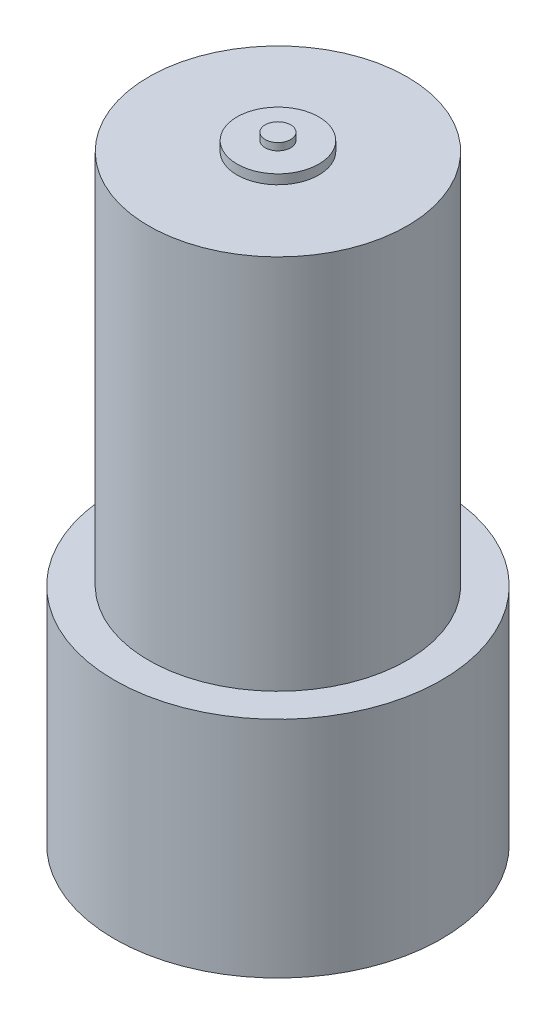
from build123d import *

# Parameters (mm, degrees)
SKETCH1_R                  = 25.4
BOSS_EXTRUDE1_DEPTH        = 34.798
SKETCH2_R                  = 20.066
BOSS_EXTRUDE2_DEPTH        = 58.42
SKETCH3_R                  = 14.224
BOSS_EXTRUDE3_DEPTH        = 1.524
SKETCH4_R                  = 6.35
BOSS_EXTRUDE4_DEPTH        = 1.4732
SKETCH5_R                  = 1.9812
BOSS_EXTRUDE5_DEPTH        = 1.1176
SKETCH6_R                  = 2.9464
BOSS_EXTRUDE6_DEPTH        = 17.526
F_10_32_TAPPED_HOLE1_D     = 4.0386
F_10_32_TAPPED_HOLE1_DEPTH = 6.35
F_10_32_TAPPED_HOLE1_TIP   = 1.213317848


with BuildPart() as part:
    # Sketch1 → Boss-Extrude1 (new body)
    with BuildSketch(Plane(origin=(0, 0, 0), x_dir=(1, 0, 0), z_dir=(0, 1, 0))):
        with Locations(Location((0, 0, 0), (0, 0, 270))):
            Circle(SKETCH1_R)
    extrude(amount=BOSS_EXTRUDE1_DEPTH)

    # Sketch2 → Boss-Extrude2 (add)
    with BuildSketch(Plane(origin=(0, 34.798, 0), x_dir=(-1, 0, 0), z_dir=(0, 1, 0))):
        with Locations(Location((0, 0, 0), (0, 0, 270))):
            Circle(SKETCH2_R)
    extrude(amount=BOSS_EXTRUDE2_DEPTH)

    # Sketch3 → Boss-Extrude3 (add)
    with BuildSketch(Plane.XZ):
        with Locations(Location((0, 0, 0), (0, 0, 90))):
            Circle(SKETCH3_R)
    extrude(amount=BOSS_EXTRUDE3_DEPTH)

    # Sketch4 → Boss-Extrude4 (add)
    with BuildSketch(Plane(origin=(0, 93.218, 0), x_dir=(-1, 0, 0), z_dir=(0, 1, 0))):
        with Locations(Location((0, 0, 0), (0, 0, 90))):
            Circle(SKETCH4_R)
    extrude(amount=BOSS_EXTRUDE4_DEPTH)

    # Sketch5 → Boss-Extrude5 (add)
    with BuildSketch(Plane(origin=(0, 94.6912, 0), x_dir=(1, 0, 0), z_dir=(0, 1, 0))):
        with Locations(Location((0, 0, 0), (0, 0, 270))):
            Circle(SKETCH5_R)
    extrude(amount=BOSS_EXTRUDE5_DEPTH)

    # Sketch6 → Boss-Extrude6 (add)
    with BuildSketch(Plane.XZ):
        with Locations(Location((-4.1783, 0, 0), (0, 0, 270))):
            Circle(SKETCH6_R)
    extrude(amount=BOSS_EXTRUDE6_DEPTH)

    # #10-32 Tapped Hole1
    with Locations(Plane.XZ):
        with Locations((0, 19.05), (0, -19.05)):
            Hole(F_10_32_TAPPED_HOLE1_D / 2, depth=F_10_32_TAPPED_HOLE1_DEPTH)
            with Locations((0, 0, -(F_10_32_TAPPED_HOLE1_DEPTH + F_10_32_TAPPED_HOLE1_TIP / 2))):  # 118° drill point
                Cone(0, F_10_32_TAPPED_HOLE1_D / 2, F_10_32_TAPPED_HOLE1_TIP, mode=Mode.SUBTRACT)


solid = part.part
